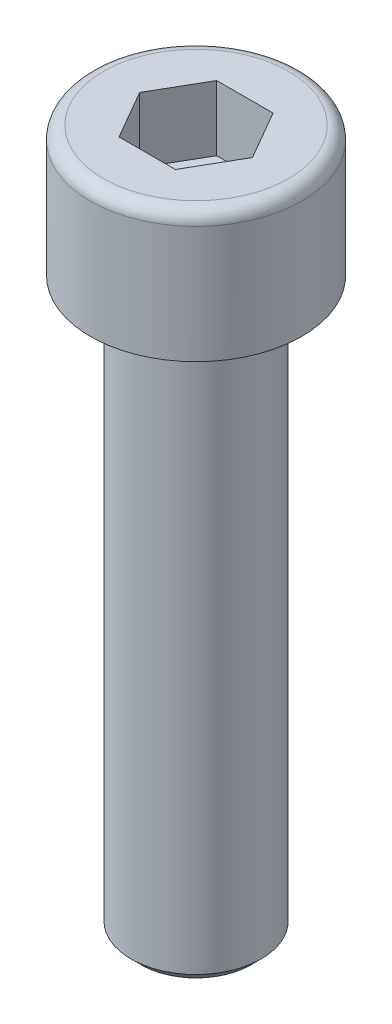
from build123d import *

# Parameters (mm, degrees)
CUT_EXTRUDE1_DEPTH = 4
FILLET3_R          = 0.8
CHAMFER1_SIZE      = 0.625


with BuildPart() as part:
    # Sketch1 → Revolve1 (revolve)
    with BuildSketch(Plane.XY, mode=Mode.PRIVATE) as revolve1_sk:
        Polygon((0, 0), (6.5, 0), (6.5, -8), (4, -8), (4, -43), (0, -43), align=None)
    revolve(revolve1_sk.sketch.rotate(Axis((0, -48, 0), (0, 1, 0)), 90), axis=Axis((0, -48, 0), (0, 1, 0)))

    # Sketch2 → Cut-Extrude1 (cut)
    with BuildSketch(Plane(origin=(0, 0, 0), x_dir=(1, 0, 0), z_dir=(0, 1, 0))):
        Polygon((3.464101615, 0), (1.732050808, 3), (-1.732050808, 3), (-3.464101615, 0), (-1.732050808, -3), (1.732050808, -3), align=None)
    extrude(amount=-CUT_EXTRUDE1_DEPTH, mode=Mode.SUBTRACT)

    # Fillet3
    fillet3_edges = [part.edges().sort_by_distance(p)[0] for p in [
        (0, 0, 6.5),
    ]]
    fillet(fillet3_edges, radius=FILLET3_R)

    # Chamfer1
    chamfer1_edges = [part.edges().sort_by_distance(p)[0] for p in [
        (0, -43, 4),
    ]]
    chamfer(chamfer1_edges, length=CHAMFER1_SIZE)


solid = part.part
